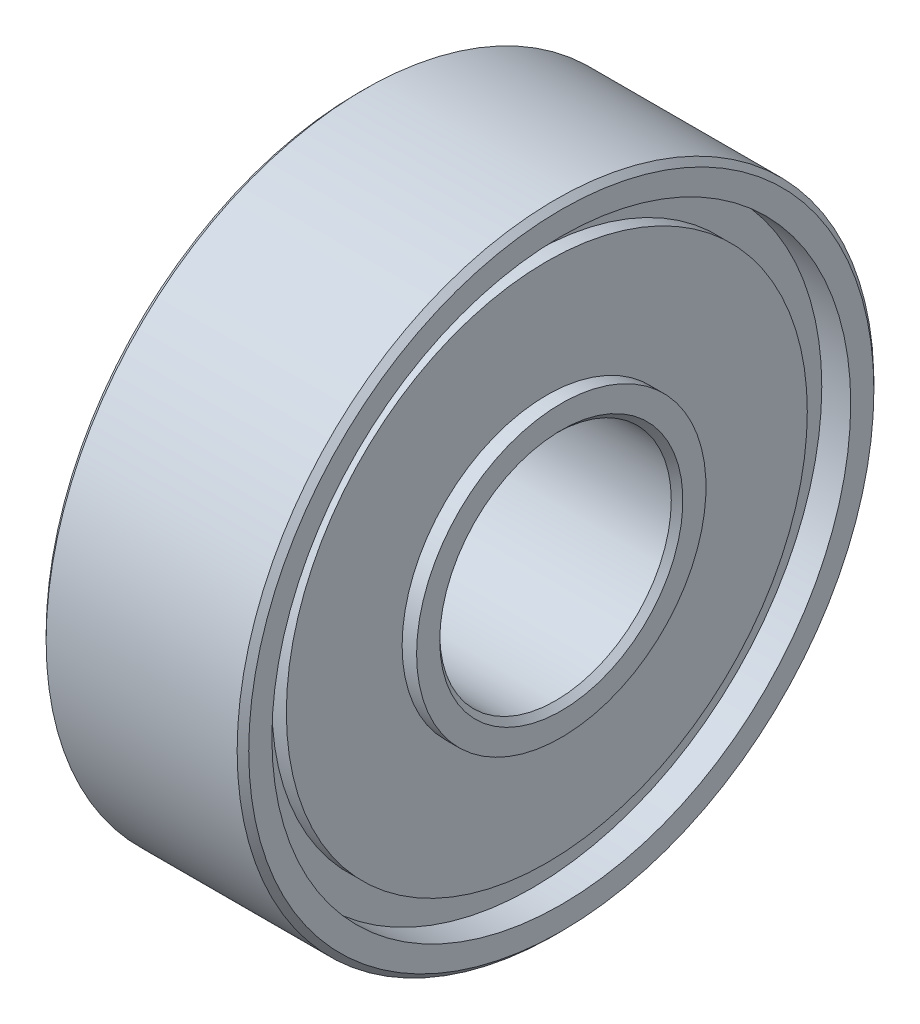
from build123d import *

# Parameters (mm, degrees)
CHAMFER_1_SIZE = 0.2


with BuildPart() as part:
    # 草图1 → 旋转1 (revolve)
    with BuildSketch(Plane.XY, mode=Mode.PRIVATE) as revolve_1_sk:
        Polygon((-3.5, 4), (3.5, 4), (3.5, 5), (3, 5), (3, 9), (2.5, 9), (2.5, 10), (3.5, 10), (3.5, 11), (-3.5, 11), (-3.5, 10), (-2.5, 10), (-2.5, 9), (-3, 9), (-3, 5), (-3.5, 5), align=None)
    revolve(revolve_1_sk.sketch.rotate(Axis((-6.476989878, 0, 0), (1, 0, 0)), 90), axis=Axis((-6.476989878, 0, 0), (1, 0, 0)))

    # 倒角1
    chamfer_1_edges = [part.edges().sort_by_distance(p)[0] for p in [
        (3.5, 0, -4),
        (-3.5, 0, -4),
        (-3.5, 0, -11),
        (3.5, 0, -11),
    ]]
    chamfer(chamfer_1_edges, length=CHAMFER_1_SIZE)


solid = part.part
